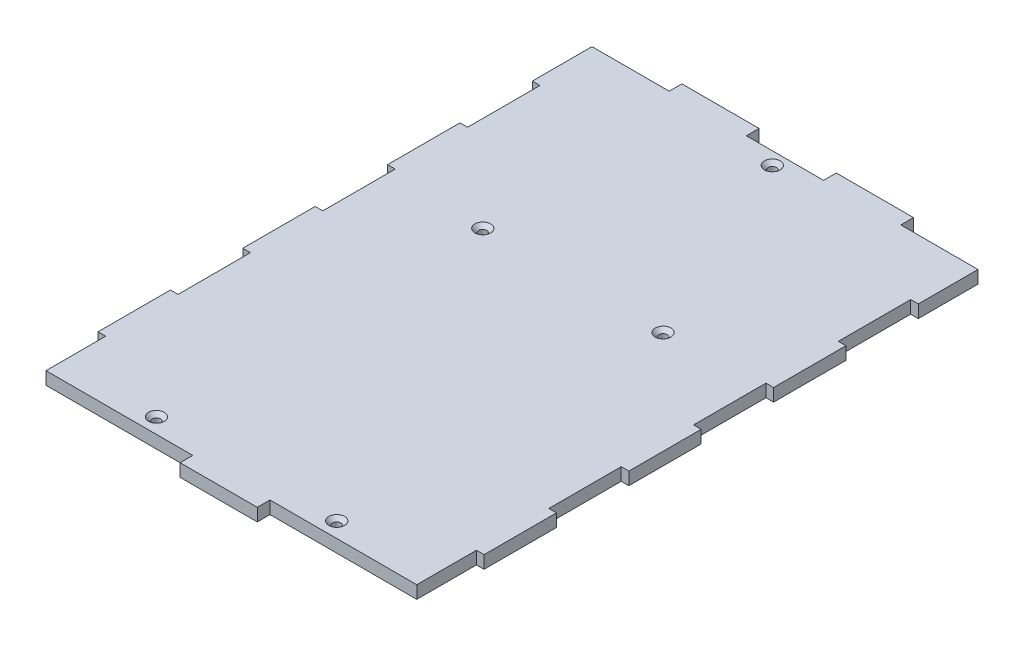
from build123d import *

# Parameters (mm, degrees)
BOSS_EXTRUDE1_DEPTH = 5
SKETCH2_R           = 1.6
CUT_EXTRUDE1_DEPTH  = 138.102151697
CHAMFER1_SIZE       = 1.5


with BuildPart() as part:
    # Sketch1 → Boss-Extrude1 (new body)
    with BuildSketch(Plane(origin=(0, 0, 0), x_dir=(1, 0, 0), z_dir=(0, 1, 0))):
        Polygon((0, -114), (-15.2, -114), (-15.2, -109), (-73, -109), (-73, -85.5), (-76, -85.5), (-76, -57), (-73, -57), (-73, -28.5), (-76, -28.5), (-76, 0), (-73, 0), (-73, 28.5), (-76, 28.5), (-76, 57), (-73, 57), (-73, 85.5), (-76, 85.5), (-76, 109), (-45.6, 109), (-45.6, 114), (-15.2, 114), (-15.2, 109), (0, 109), align=None)
    boss_extrude1 = extrude(amount=BOSS_EXTRUDE1_DEPTH)

    # Mirror1: Boss-Extrude1 across plane
    add(boss_extrude1.mirror(Plane(origin=(0, 5, 0), x_dir=(0, 0, 1), z_dir=(1, 0, 0))))

    # Sketch2 → Cut-Extrude1 (cut, through all)
    with BuildSketch(Plane(origin=(0, 5, 0), x_dir=(1, 0, 0), z_dir=(0, 1, 0))):
        with Locations(Location((0, 104, 0), (0, 0, 270))):
            Circle(SKETCH2_R)
        with Locations(Location((-35.5, 25.5, 0), (0, 0, 270))):
            Circle(SKETCH2_R)
        with Locations(Location((35.5, 25.5, 0), (0, 0, 270))):
            Circle(SKETCH2_R)
        with Locations(Location((-35.5, -103, 0), (0, 0, 270))):
            Circle(SKETCH2_R)
        with Locations(Location((35.5, -103, 0), (0, 0, 270))):
            Circle(SKETCH2_R)
    extrude(amount=-CUT_EXTRUDE1_DEPTH, mode=Mode.SUBTRACT)

    # Chamfer1
    chamfer1_edges = [part.edges().sort_by_distance(p)[0] for p in [
        (0, 5, -105.6),
        (35.5, 5, -27.1),
        (-35.5, 5, -27.1),
        (-35.5, 5, 101.4),
        (35.5, 5, 101.4),
    ]]
    chamfer(chamfer1_edges, length=CHAMFER1_SIZE)


solid = part.part
